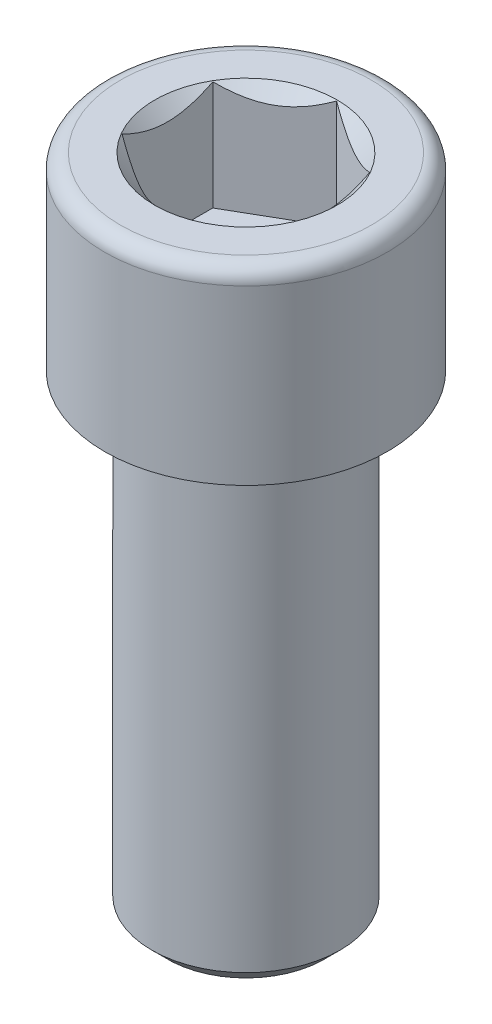
from build123d import *

# Parameters (mm, degrees)
SZKIC1_R                   = 9
WYCI_GNI_CIE1_DEPTH        = 12
SZKIC2_R                   = 6
WYCI_GNI_CIE2_DEPTH        = 30
WYTNIJ_WYCI_GNI_CIE1_DEPTH = 7
SZKIC4_R                   = 5.810938268
WYTNIJ_WYCI_GNI_CIE2_DEPTH = 2
WYTNIJ_WYCI_GNI_CIE2_DRAFT = -45
ZAOKR_GLENIE1_R            = 1
SFAZOWANIE1_SIZE           = 1


with BuildPart() as part:
    # Szkic1 → Wyciągnięcie1 (new body)
    with BuildSketch(Plane(origin=(0, 0, 0), x_dir=(1, 0, 0), z_dir=(0, 1, 0))):
        with Locations(Location((0, 0, 0), (0, 0, 270))):
            Circle(SZKIC1_R)
    extrude(amount=WYCI_GNI_CIE1_DEPTH)

    # Szkic2 → Wyciągnięcie2 (add)
    with BuildSketch(Plane.XZ):
        with Locations(Location((0, 0, 0), (0, 0, 90))):
            Circle(SZKIC2_R)
    extrude(amount=WYCI_GNI_CIE2_DEPTH)

    # Szkic3 → Wytnij-wyciągnięcie1 (cut)
    with BuildSketch(Plane(origin=(0, 12, 0), x_dir=(-1, 0, 0), z_dir=(0, 1, 0))):
        Polygon((0, 5.773502692), (-5, 2.886751346), (-5, -2.886751346), (0, -5.773502692), (5, -2.886751346), (5, 2.886751346), align=None)
    extrude(amount=-WYTNIJ_WYCI_GNI_CIE1_DEPTH, mode=Mode.SUBTRACT)


with BuildPart() as wytnij_wyci_gni_cie2_tool:
    # Szkic4 → Wytnij-wyciągnięcie2 (with draft: the straight prism first)
    with BuildSketch(Plane(origin=(0, 12, 0), x_dir=(-1, 0, 0), z_dir=(0, 1, 0))):
        Circle(SZKIC4_R)
    extrude(amount=-WYTNIJ_WYCI_GNI_CIE2_DEPTH)
    # Wytnij-wyciągnięcie2: the draft: its side faces are tilted about the plane it starts from
    wytnij_wyci_gni_cie2_sides = [wytnij_wyci_gni_cie2_tool.faces().sort_by_distance(p)[0] for p in [
        (5.810938268, 11, 0),
    ]]
    draft(wytnij_wyci_gni_cie2_sides, Plane(origin=(0, 12, 0), x_dir=(-1, 0, 0), z_dir=(0, 1, 0)), WYTNIJ_WYCI_GNI_CIE2_DRAFT)


with BuildPart() as part_1:
    add(part.part)

    # Wytnij-wyciągnięcie2: cut by wytnij_wyci_gni_cie2_tool
    add(wytnij_wyci_gni_cie2_tool.part, mode=Mode.SUBTRACT)

    # Zaokrąglenie1
    zaokr_glenie1_edges = [part_1.edges().sort_by_distance(p)[0] for p in [
        (0, 12, -9),
    ]]
    fillet(zaokr_glenie1_edges, radius=ZAOKR_GLENIE1_R)

    # Sfazowanie1
    sfazowanie1_edges = [part_1.edges().sort_by_distance(p)[0] for p in [
        (0, -30, -6),
    ]]
    chamfer(sfazowanie1_edges, length=SFAZOWANIE1_SIZE)


solid = part_1.part
